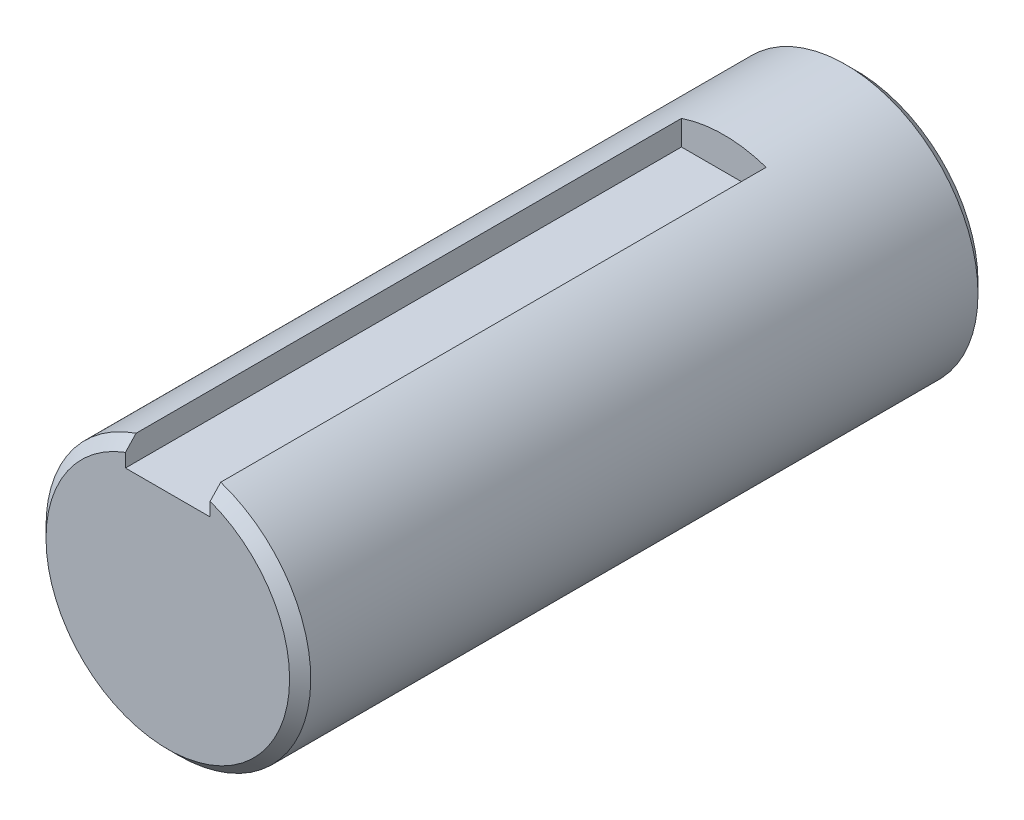
from build123d import *

# Parameters (mm, degrees)
BOSS_EXTRUDE1_DEPTH = 130
BOSS_EXTRUDE2_DEPTH = 25
CHAMFER1_SIZE       = 2


with BuildPart() as part:
    # Sketch1 → Boss-Extrude1 (new body)
    with BuildSketch(Plane.XY):
        with BuildLine():
            Line((-8, 19), (8, 19))
            Line((8, 19), (8, 23.685438565))
            ThreePointArc((8, 23.685438565), (0, -25), (-8, 23.685438565))
            Line((-8, 23.685438565), (-8, 19))
        make_face()
    extrude(amount=BOSS_EXTRUDE1_DEPTH)

    # Sketch2 → Boss-Extrude2 (add)
    with BuildSketch(Plane(origin=(0, 0, 0), x_dir=(-1, 0, 0), z_dir=(0, 0, -1))):
        with BuildLine():
            Line((-8, 23.685438565), (-8, 19))
            Line((-8, 19), (8, 19))
            Line((8, 19), (8, 23.685438565))
            ThreePointArc((8, 23.685438565), (0, 25), (-8, 23.685438565))
        make_face()
    extrude(amount=-BOSS_EXTRUDE2_DEPTH)

    # Chamfer1
    chamfer1_edges = [part.edges().sort_by_distance(p)[0] for p in [
        (0, -25, 130),
        (8, -23.685438565, 0),
    ]]
    chamfer(chamfer1_edges, length=CHAMFER1_SIZE)


solid = part.part
